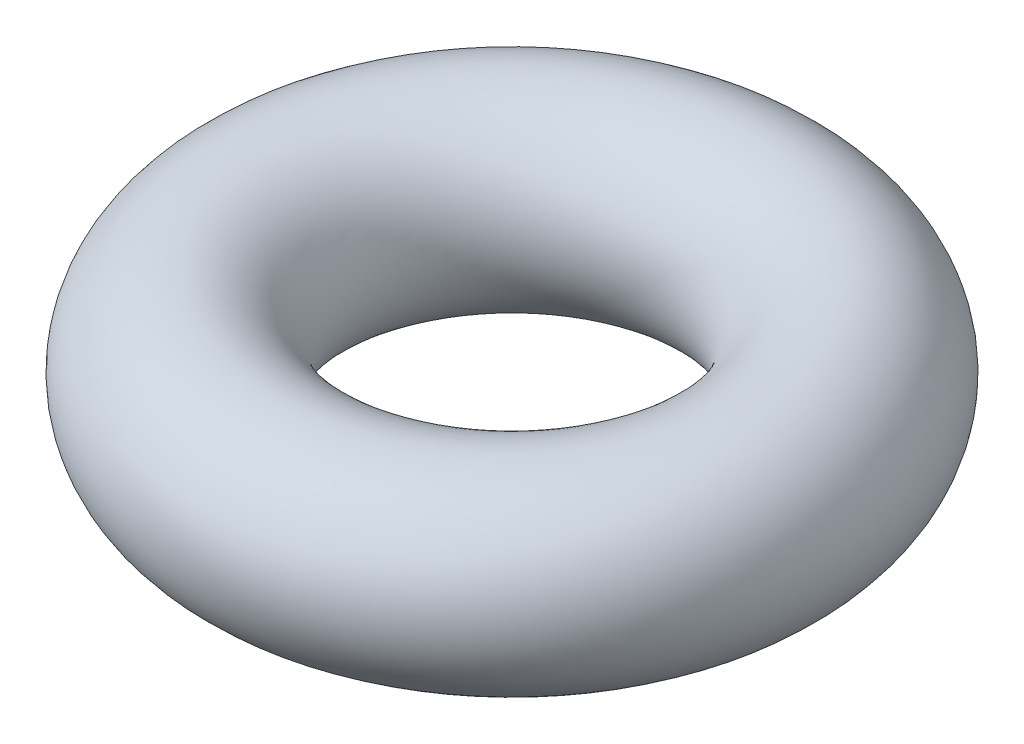
from build123d import *

# Parameters (mm, degrees)
SKETCH2_R   = 40
SKETCH2_R_2 = 30


with BuildPart() as part:
    # Sketch2 → Revolve-Thin1 (revolve)
    with BuildSketch(Plane.XY, mode=Mode.PRIVATE) as revolve_thin1_sk:
        with Locations((-100, 0)):
            Circle(SKETCH2_R)
        with Locations((-100, 0)):
            Circle(SKETCH2_R_2, mode=Mode.SUBTRACT)
    revolve(revolve_thin1_sk.sketch.rotate(Axis((0, 75.972413793, 0), (0, -1, 0)), 270), axis=Axis((0, 75.972413793, 0), (0, -1, 0)))


solid = part.part
